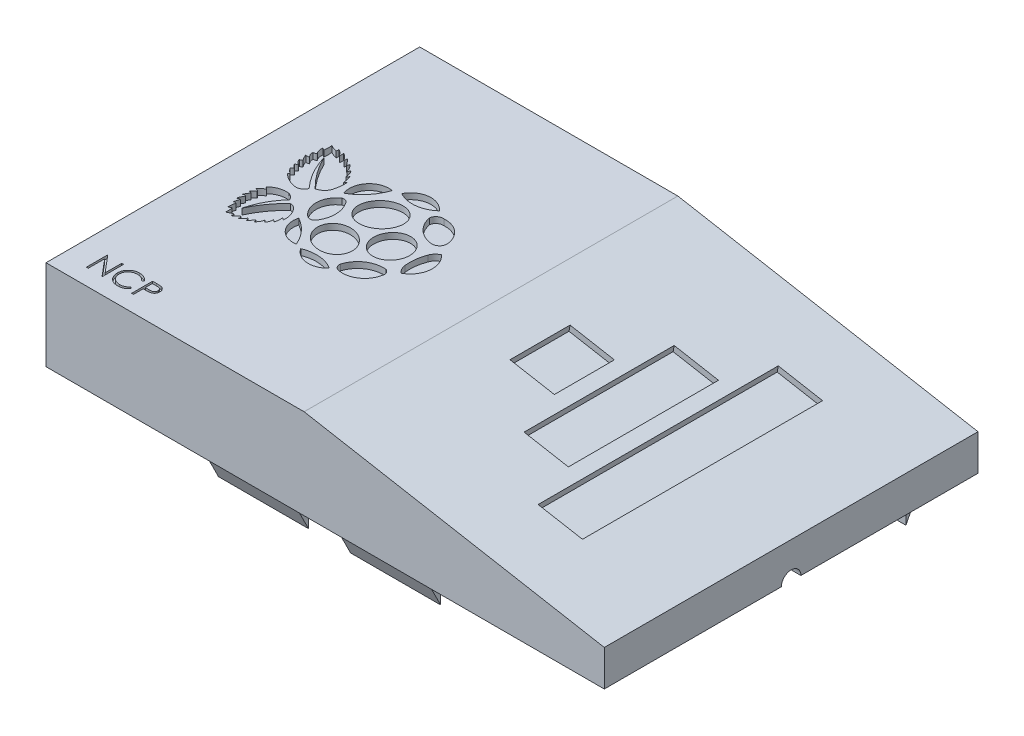
from build123d import *

# Parameters (mm, degrees)
BOSS_EXTRUDE1_DEPTH  = 62.25
SHELL2_T             = -3
SKETCH2_RX           = 3.23434453
SKETCH2_RY           = 2.836223113
SKETCH2_RX_2         = 3.027402498
SKETCH2_RY_2         = 2.793583879
SKETCH2_RX_3         = 3.441458498
SKETCH2_RY_3         = 2.879392248
CUT_EXTRUDE1_DEPTH   = 1
CUT_EXTRUDE2_DEPTH   = 0.5
CUT_EXTRUDE3_DEPTH   = 3
SKETCH5_W            = 7.5
SKETCH5_H            = 40
SKETCH5_H_2          = 25
SKETCH5_H_3          = 10
CUT_EXTRUDE4_DEPTH   = 1
SKETCH6_R            = 1.75
BOSS_EXTRUDE2_DEPTH  = 10.25
SKETCH7_R            = 0.775
BOSS_EXTRUDE3_DEPTH  = 5.75
BOSS_EXTRUDE4_REACH  = 114.912
SKETCH8_W            = 15
SKETCH8_H            = 3
BOSS_EXTRUDE5_REACH  = 114.912
SKETCH9_W            = 15
SKETCH9_H            = 3
SKETCH10_W           = 15
SKETCH10_H           = 1
BOSS_EXTRUDE6_DEPTH  = 5.5
BOSS_EXTRUDE8_DEPTH  = 15
SKETCH14_W           = 5
SKETCH14_H           = 5
BOSS_EXTRUDE9_DEPTH  = 8.25
BOSS_EXTRUDE10_DEPTH = 15
BOSS_EXTRUDE11_DEPTH = 15


with BuildPart() as part:
    # Sketch1 → Boss-Extrude1 (new body)
    with BuildSketch(Plane.XY):
        Polygon((93, 0), (93, 6), (43, 15), (0, 15), (0, 0), align=None)
    extrude(amount=BOSS_EXTRUDE1_DEPTH)

    # Shell2
    shell2_openings = [part.faces().sort_by_distance(p)[0] for p in [
        (46.5, 0, 31.125),
    ]]
    offset(amount=SHELL2_T, openings=shell2_openings, kind=Kind.INTERSECTION)

    # Sketch2 → Cut-Extrude1 (cut)
    with BuildSketch(Plane(origin=(0, 15, 0), x_dir=(1, 0, 0), z_dir=(0, 1, 0))):
        with Locations(Location((20.631271905, -34.758953335), (0, 0, -23.180752632))):
            Ellipse(SKETCH2_RX, SKETCH2_RY)
        with Locations(Location((26.430753429, -31.093375761), (0, 0, 67.737970758))):
            Ellipse(SKETCH2_RX_2, SKETCH2_RY_2)
        with Locations(Location((20.972849689, -27.417458451), (0, 0, 38.365764852))):
            Ellipse(SKETCH2_RX_3, SKETCH2_RY_3)
        with BuildLine():
            ThreePointArc((19.185670236, -38.995990222), (21.842438252, -38.58362755), (24.394817778, -39.428505064))
            ThreePointArc((24.394817778, -39.428505064), (21.682718032, -40.507275271), (19.185670236, -38.995990222))
        make_face()
        with BuildLine():
            ThreePointArc((18.166589072, -38.720020325), (15.308161244, -37.710999288), (14.619570081, -34.758953335))
            ThreePointArc((14.619570081, -34.758953335), (16.725817208, -36.441530067), (18.166589072, -38.720020325))
        make_face()
        with BuildLine():
            ThreePointArc((24.716824031, -37.876288705), (24.858709382, -38.594954098), (25.470039922, -38.998545936))
            ThreePointArc((25.470039922, -38.998545936), (28.268081035, -38.418240356), (29.840480019, -36.03216616))
            ThreePointArc((29.840480019, -36.03216616), (29.78091761, -35.332578316), (29.244117319, -34.880011991))
            ThreePointArc((29.244117319, -34.880011991), (26.454283148, -35.583095189), (24.716824031, -37.876288705))
        make_face()
        with BuildLine():
            ThreePointArc((31.099176128, -34.170223925), (33.031172545, -31.349868691), (31.784927148, -28.166492148))
            ThreePointArc((31.784927148, -28.166492148), (31.137173961, -28.624802335), (30.71685995, -29.297831718))
            ThreePointArc((30.71685995, -29.297831718), (30.296643254, -30.984618483), (30.285678757, -32.722925545))
            ThreePointArc((30.285678757, -32.722925545), (30.545941708, -33.528911427), (31.099176128, -34.170223925))
        make_face()
        with BuildLine():
            ThreePointArc((15.308161244, -33.895118663), (13.825431994, -31.093375761), (15.308161244, -28.29163286))
            ThreePointArc((15.308161244, -28.29163286), (15.963769898, -28.308210395), (16.415633136, -28.783517808))
            ThreePointArc((16.415633136, -28.783517808), (17.111216318, -31.083876315), (16.491877072, -33.405923715))
            ThreePointArc((16.491877072, -33.405923715), (16.001334749, -33.895676764), (15.308161244, -33.895118663))
        make_face()
        with BuildLine():
            ThreePointArc((19.658735939, -22.647390073), (22.574976673, -23.238989758), (25.283843408, -22.007530779))
            ThreePointArc((25.283843408, -22.007530779), (22.298505034, -20.80848246), (19.658735939, -22.647390073))
        make_face()
        with BuildLine():
            ThreePointArc((30.71685995, -26.154029327), (29.465454563, -23.656015485), (26.814214801, -22.774530193))
            ThreePointArc((26.814214801, -22.774530193), (25.920656617, -23.030820136), (25.470039922, -23.843885544))
            ThreePointArc((25.470039922, -23.843885544), (26.841313913, -26.284543001), (29.401334179, -27.417458451))
            ThreePointArc((29.401334179, -27.417458451), (30.320761804, -27.058198197), (30.71685995, -26.154029327))
        make_face()
        with BuildLine():
            ThreePointArc((14.767462088, -27.417458451), (17.012003821, -25.556638731), (18.419100349, -23.003073186))
            ThreePointArc((18.419100349, -23.003073186), (15.302587522, -24.142586809), (14.767462088, -27.417458451))
        make_face()
        with BuildLine():
            ThreePointArc((11.751124031, -29.17536075), (9.635588773, -26.71867726), (7.985576374, -23.927935015))
            ThreePointArc((7.985576374, -23.927935015), (9.267010798, -26.972614766), (11.219001446, -29.637550317))
            ThreePointArc((11.219001446, -29.637550317), (10.735019108, -30.257573014), (10.00410177, -30.548136076))
            ThreePointArc((10.00410177, -30.548136076), (8.498848306, -30.153077222), (7.232695965, -29.248246995))
            ThreePointArc((7.232695965, -29.248246995), (7.37305971, -29.184304352), (7.463335639, -29.059240771))
            ThreePointArc((7.463335639, -29.059240771), (7.014832676, -28.68009702), (6.644712677, -28.224118865))
            ThreePointArc((6.644712677, -28.224118865), (6.869538831, -28.113666589), (7.025438864, -27.917601077))
            ThreePointArc((7.025438864, -27.917601077), (6.683487621, -27.632259645), (6.426811997, -27.268298096))
            ThreePointArc((6.426811997, -27.268298096), (6.661203353, -27.192178891), (6.773118664, -26.972614766))
            ThreePointArc((6.773118664, -26.972614766), (6.386561226, -26.669975183), (6.210587584, -26.211662356))
            ThreePointArc((6.210587584, -26.211662356), (6.448864602, -26.197888677), (6.607612436, -26.019661921))
            ThreePointArc((6.607612436, -26.019661921), (6.296357608, -25.563867131), (6.111687011, -25.043746734))
            ThreePointArc((6.111687011, -25.043746734), (6.400927747, -25.125688799), (6.685359918, -25.028359229))
            ThreePointArc((6.685359918, -25.028359229), (6.399917656, -24.58920021), (6.324178136, -24.070932466))
            ThreePointArc((6.324178136, -24.070932466), (6.607612436, -24.05547907), (6.825070706, -23.873035351))
            ThreePointArc((6.825070706, -23.873035351), (6.540131271, -23.284926697), (6.53816595, -22.631429638))
            ThreePointArc((6.53816595, -22.631429638), (6.712331192, -22.761572665), (6.902343049, -22.867243065))
            ThreePointArc((6.902343049, -22.867243065), (6.938252957, -22.193310389), (6.902343049, -21.519377713))
            ThreePointArc((6.902343049, -21.519377713), (7.448107739, -21.789561041), (8.035360737, -21.95078152))
            ThreePointArc((8.035360737, -21.95078152), (8.080869441, -21.7297657), (8.05421252, -21.505693293))
            ThreePointArc((8.05421252, -21.505693293), (8.573506731, -21.871613602), (8.976097896, -22.363024331))
            ThreePointArc((8.976097896, -22.363024331), (9.051359196, -22.002256971), (8.976097896, -21.641489611))
            ThreePointArc((8.976097896, -21.641489611), (9.571020242, -22.062954422), (10.00410177, -22.649474305))
            ThreePointArc((10.00410177, -22.649474305), (10.087922339, -22.420796241), (10.111101081, -22.178345646))
            ThreePointArc((10.111101081, -22.178345646), (10.587461655, -22.649474305), (10.985307512, -23.188547847))
            ThreePointArc((10.985307512, -23.188547847), (11.084012341, -22.986854403), (11.157096668, -22.774530193))
            ThreePointArc((11.157096668, -22.774530193), (11.619719738, -23.322092661), (11.901316316, -23.981295308))
            ThreePointArc((11.901316316, -23.981295308), (12.053319009, -23.800204284), (12.132092522, -23.57728387))
            ThreePointArc((12.132092522, -23.57728387), (12.470152649, -24.16846626), (12.580830754, -24.840427289))
            ThreePointArc((12.580830754, -24.840427289), (12.77239144, -24.699316611), (12.90167999, -24.499586315))
            ThreePointArc((12.90167999, -24.499586315), (13.094991638, -25.18121396), (13.205333447, -25.881078465))
            ThreePointArc((13.205333447, -25.881078465), (13.381113204, -25.742603991), (13.528203923, -25.57396822))
            ThreePointArc((13.528203923, -25.57396822), (13.512795769, -26.501513065), (13.365755297, -27.417458451))
            ThreePointArc((13.365755297, -27.417458451), (12.837442533, -28.552673418), (11.751124031, -29.17536075))
        make_face()
        with BuildLine():
            ThreePointArc((13.605414659, -36.318076611), (13.498458727, -35.136716824), (12.997756974, -34.061380471))
            ThreePointArc((12.997756974, -34.061380471), (12.492924369, -33.555602946), (11.805799387, -33.35932222))
            ThreePointArc((11.805799387, -33.35932222), (9.892492412, -35.554038044), (8.436697165, -38.075581485))
            ThreePointArc((8.436697165, -38.075581485), (9.49602013, -35.306132831), (11.203487812, -32.881970067))
            ThreePointArc((11.203487812, -32.881970067), (10.811735268, -32.339768722), (10.233723882, -32.003086095))
            ThreePointArc((10.233723882, -32.003086095), (8.670972956, -32.154514728), (7.3610336, -33.020066559))
            ThreePointArc((7.3610336, -33.020066559), (7.579950403, -33.104877308), (7.752534528, -33.264038073))
            ThreePointArc((7.752534528, -33.264038073), (7.213574572, -33.616322393), (6.75760503, -34.070936351))
            ThreePointArc((6.75760503, -34.070936351), (7.051006992, -34.140049949), (7.277374173, -34.339095925))
            ThreePointArc((7.277374173, -34.339095925), (6.904175554, -34.629644492), (6.592098801, -34.985036924))
            ThreePointArc((6.592098801, -34.985036924), (6.834031953, -35.011315135), (7.051006992, -35.121515074))
            ThreePointArc((7.051006992, -35.121515074), (6.729000874, -35.529870649), (6.496018821, -35.99480245))
            ThreePointArc((6.496018821, -35.99480245), (6.755668882, -35.91427056), (7.00992523, -36.010485158))
            ThreePointArc((7.00992523, -36.010485158), (6.718960287, -36.53182792), (6.522652316, -37.095673692))
            ThreePointArc((6.522652316, -37.095673692), (6.779425822, -36.969598454), (7.063811622, -36.938738839))
            ThreePointArc((7.063811622, -36.938738839), (6.897044504, -37.409309824), (6.834031953, -37.904565052))
            ThreePointArc((6.834031953, -37.904565052), (7.029997052, -37.793358402), (7.247200278, -37.853291676))
            ThreePointArc((7.247200278, -37.853291676), (7.103093714, -38.472352232), (7.111126027, -39.107913525))
            ThreePointArc((7.111126027, -39.107913525), (7.31167282, -38.935411013), (7.52964566, -38.785531148))
            ThreePointArc((7.52964566, -38.785531148), (7.666908764, -39.395322635), (7.618990005, -40.018532559))
            ThreePointArc((7.618990005, -40.018532559), (8.116769004, -39.7536522), (8.641559274, -39.54739821))
            ThreePointArc((8.641559274, -39.54739821), (8.642255696, -39.7854208), (8.594150125, -40.018532559))
            ThreePointArc((8.594150125, -40.018532559), (9.094097677, -39.734432014), (9.445237768, -39.279062593))
            ThreePointArc((9.445237768, -39.279062593), (9.641766594, -39.511186579), (9.616597015, -39.81428989))
            ThreePointArc((9.616597015, -39.81428989), (10.067422402, -39.467270281), (10.386109152, -38.995990222))
            ThreePointArc((10.386109152, -38.995990222), (10.516261514, -39.215443686), (10.557283781, -39.467270281))
            ThreePointArc((10.557283781, -39.467270281), (10.962236903, -39.043554997), (11.313447943, -38.574329594))
            ThreePointArc((11.313447943, -38.574329594), (11.419755277, -38.772728326), (11.448346047, -38.995990222))
            ThreePointArc((11.448346047, -38.995990222), (11.860994573, -38.474010937), (12.074288796, -37.843735795))
            ThreePointArc((12.074288796, -37.843735795), (12.227921415, -38.019403411), (12.290432759, -38.244246523))
            ThreePointArc((12.290432759, -38.244246523), (12.6356413, -37.723904453), (12.720147908, -37.105209504))
            ThreePointArc((12.720147908, -37.105209504), (12.928043084, -37.217676076), (13.078763965, -37.399753943))
            ThreePointArc((13.078763965, -37.399753943), (13.237628543, -36.734205165), (13.205333447, -36.050721326))
            ThreePointArc((13.205333447, -36.050721326), (13.416456641, -36.167814539), (13.605414659, -36.318076611))
        make_face()
    extrude(amount=-CUT_EXTRUDE1_DEPTH, mode=Mode.SUBTRACT)

    # Sketch3 → Cut-Extrude2 (cut)
    # profile 1 of 3: a face of its own
    with BuildSketch(Plane(origin=(0, 15, 0), x_dir=(1, 0, 0), z_dir=(0, 1, 0))):
        Polygon((4.004218303, -59.534994611), (4.004218303, -56.034994611), (4.070123752, -56.034994611), (6.382423431, -58.789702143), (6.382423431, -56.034994611), (6.696525995, -56.034994611), (6.696525995, -59.534994611), (6.625011572, -59.534994611), (4.318320867, -56.786597175), (4.318320867, -59.534994611), align=None)
    # profile 2 of 3: a face of its own
    with BuildSketch(Plane(origin=(0, 15, 0), x_dir=(1, 0, 0), z_dir=(0, 1, 0))):
        with BuildLine():
            Line((10.824731123, -56.677222175), (10.54989138, -56.887558713))
            add(Edge.make_bspline(
                [(10.54989138, -56.887558713), (10.530285491, -56.864192743), (10.491338045, -56.817775828), (10.428678842, -56.752596283), (10.363377199, -56.691531022), (10.295458078, -56.634289142), (10.223698959, -56.582872376), (10.14983816, -56.534601273), (10.072640115, -56.491333535), (9.96588838, -56.438870549), (9.826240532, -56.384124394), (9.650445693, -56.338221163), (9.466934594, -56.308999987), (9.341736995, -56.305835146), (9.278056444, -56.30422538)],
                knots=[0, 0, 0, 0, 0.757959112, 1.505699292, 2.245454638, 2.979532153, 3.711538275, 4.438200793, 5.171680507, 5.909471876, 7.393775596, 8.890124382, 10.418191784, 12, 12, 12, 12], degree=3))
            add(Edge.make_bspline(
                [(9.278056444, -56.30422538), (9.242973145, -56.304629342), (9.173132152, -56.305433518), (9.069483679, -56.316042643), (8.967770627, -56.330953853), (8.868059161, -56.353079177), (8.770476203, -56.381051796), (8.674383801, -56.41447721), (8.581173201, -56.45583205), (8.489554963, -56.50154031), (8.401775752, -56.553167754), (8.318720704, -56.609481106), (8.240692736, -56.669850203), (8.167630124, -56.734501309), (8.099458175, -56.803143269), (8.036670865, -56.876507611), (7.979485454, -56.954359785), (7.926768429, -57.035673192), (7.879555696, -57.120210984), (7.840025817, -57.208286054), (7.805020694, -57.298390157), (7.777321452, -57.391541318), (7.755396935, -57.487084084), (7.740269272, -57.585274872), (7.7297808, -57.685908551), (7.728980623, -57.754117864), (7.728577277, -57.78850022)],
                knots=[0, 0, 0, 0, 1.054917814, 2.100044995, 3.131103042, 4.146048494, 5.169673617, 6.183595914, 7.203665975, 8.234915748, 9.262203917, 10.264457458, 11.251630812, 12.227803204, 13.197192746, 14.159520551, 15.12972552, 16.100847026, 17.073214652, 18.039054194, 19.002613845, 19.979014051, 20.95965708, 21.949030935, 22.966165397, 24, 24, 24, 24], degree=3))
            add(Edge.make_bspline(
                [(7.728577277, -57.78850022), (7.729839096, -57.84023154), (7.732316511, -57.941799124), (7.754364845, -58.090569735), (7.787869936, -58.233090409), (7.838085513, -58.368470251), (7.900004563, -58.498378609), (7.978245175, -58.620617462), (8.068861712, -58.737034027), (8.173136132, -58.844876975), (8.287541948, -58.9433907), (8.410289859, -59.030141282), (8.541074147, -59.102456164), (8.678450777, -59.162632111), (8.823476891, -59.208888838), (8.975891694, -59.241452962), (9.135363689, -59.262695142), (9.244333089, -59.26472883), (9.29979122, -59.265763841)],
                knots=[0, 0, 0, 0, 1.029171465, 2.020641659, 2.987623507, 3.938342917, 4.889210282, 5.84687017, 6.821220943, 7.821438502, 8.827599549, 9.822697543, 10.807740252, 11.797342354, 12.80366471, 13.83203677, 14.896651826, 16, 16, 16, 16], degree=3))
            add(Edge.make_bspline(
                [(9.29979122, -59.265763841), (9.360893909, -59.264075062), (9.481158617, -59.260751139), (9.657526644, -59.23259189), (9.826362409, -59.186933972), (9.987674996, -59.12303605), (10.141009642, -59.039970762), (10.286606303, -58.939272885), (10.424587873, -58.819984552), (10.507559155, -58.728901423), (10.54989138, -58.682430508)],
                knots=[0, 0, 0, 0, 1.028121516, 2.023589091, 2.998037872, 3.967518031, 4.937445131, 5.927275754, 6.942489185, 8, 8, 8, 8], degree=3))
            Line((10.54989138, -58.682430508), (10.824731123, -58.890663681))
            add(Edge.make_bspline(
                [(10.824731123, -58.890663681), (10.802613014, -58.919202133), (10.758482738, -58.976142339), (10.687024721, -59.056414049), (10.611747424, -59.131918085), (10.532091714, -59.202045706), (10.448973922, -59.268200171), (10.36090161, -59.328502003), (10.269032577, -59.383792887), (10.173678099, -59.434419811), (10.074939486, -59.479337058), (9.972935051, -59.517790826), (9.868104475, -59.550915716), (9.760442967, -59.578167653), (9.64972721, -59.599438736), (9.536356736, -59.613658411), (9.420086861, -59.623400326), (9.34164544, -59.624288242), (9.301894585, -59.6247382)],
                knots=[0, 0, 0, 0, 0.986787822, 1.968848986, 2.935600012, 3.899624008, 4.868462664, 5.837806735, 6.815139263, 7.798259679, 8.787526145, 9.778297419, 10.776456485, 11.791383307, 12.812564526, 13.85620153, 14.913611965, 16, 16, 16, 16], degree=3))
            add(Edge.make_bspline(
                [(9.301894585, -59.6247382), (9.264250918, -59.624476208), (9.189815228, -59.62395815), (9.079916476, -59.615565983), (8.972926895, -59.604116246), (8.86915227, -59.586876115), (8.768026294, -59.566531775), (8.67046571, -59.539260518), (8.5755105, -59.508711351), (8.483542159, -59.472806365), (8.394482459, -59.432290182), (8.308618648, -59.386498623), (8.225990215, -59.335816758), (8.145784795, -59.281361748), (8.069187211, -59.221384446), (7.995533685, -59.156717812), (7.924411209, -59.087579801), (7.880408524, -59.037724948), (7.858284809, -59.012658873)],
                knots=[0, 0, 0, 0, 1.114604814, 2.203992996, 3.262667896, 4.300477797, 5.318619304, 6.316056647, 7.298880507, 8.271930387, 9.238335007, 10.195173496, 11.151986948, 12.108099108, 13.064862484, 14.031167946, 15.010108607, 16, 16, 16, 16], degree=3))
            add(Edge.make_bspline(
                [(7.858284809, -59.012658873), (7.822849166, -58.969117685), (7.752405689, -58.882560974), (7.662280005, -58.742274993), (7.58513245, -58.595806784), (7.522756529, -58.442386855), (7.473993796, -58.282359468), (7.440212601, -58.115643954), (7.418260997, -57.942396011), (7.415750708, -57.824559223), (7.414474713, -57.764662079)],
                knots=[0, 0, 0, 0, 0.994628077, 1.977248131, 2.950237994, 3.925870899, 4.908910175, 5.911660606, 6.938484602, 8, 8, 8, 8], degree=3))
            add(Edge.make_bspline(
                [(7.414474713, -57.764662079), (7.416029907, -57.701706625), (7.419089653, -57.5778457), (7.445085448, -57.396071747), (7.486904245, -57.221920348), (7.546301133, -57.055716604), (7.621606485, -56.896586324), (7.714633098, -56.745745119), (7.824300241, -56.602228319), (7.949747808, -56.468213568), (8.087315144, -56.345674215), (8.234633957, -56.237868011), (8.391415904, -56.148150495), (8.555933756, -56.073154333), (8.729419438, -56.01550987), (8.911502807, -55.975156683), (9.101841722, -55.950039567), (9.231704147, -55.946864359), (9.297687854, -55.945251021)],
                knots=[0, 0, 0, 0, 1.032925535, 2.032216505, 3.007276963, 3.968222605, 4.92396291, 5.891752235, 6.871517503, 7.883894988, 8.900124299, 9.891468569, 10.874487609, 11.85992873, 12.854644235, 13.869047385, 14.917252991, 16, 16, 16, 16], degree=3))
            add(Edge.make_bspline(
                [(9.297687854, -55.945251021), (9.337902326, -55.945733159), (9.417502823, -55.946687503), (9.535255476, -55.955993645), (9.649897803, -55.971507251), (9.761508785, -55.992623321), (9.870631401, -56.018830643), (9.976431642, -56.052970941), (10.079530329, -56.092007472), (10.179277237, -56.136965938), (10.275193787, -56.18743268), (10.367250106, -56.242848303), (10.454714964, -56.303144109), (10.538203813, -56.367807284), (10.616320024, -56.438205843), (10.691281502, -56.512403439), (10.760542581, -56.592537264), (10.803295776, -56.648942197), (10.824731123, -56.677222175)],
                knots=[0, 0, 0, 0, 1.096760587, 2.17092713, 3.219439832, 4.250915756, 5.268269357, 6.278326846, 7.281116186, 8.274029601, 9.260640565, 10.235837813, 11.203064059, 12.156899882, 13.114053108, 14.069676657, 15.032185724, 16, 16, 16, 16], degree=3))
        make_face()
    # profile 3 of 3: a face of its own
    with BuildSketch(Plane(origin=(0, 15, 0), x_dir=(1, 0, 0), z_dir=(0, 1, 0))):
        with BuildLine():
            Line((11.542679841, -56.034994611), (12.229078079, -56.034994611))
            add(Edge.make_bspline(
                [(12.229078079, -56.034994611), (12.276288985, -56.035046507), (12.366747178, -56.035145942), (12.496462233, -56.038160688), (12.614271965, -56.04218738), (12.719922346, -56.047769273), (12.813738444, -56.054365864), (12.895295743, -56.063617903), (12.9652353, -56.073278199), (13.007141749, -56.083099605), (13.026253559, -56.087578745)],
                knots=[0, 0, 0, 0, 1.415646017, 2.712440637, 3.8905458, 4.950247383, 5.884950622, 6.709939814, 7.411656543, 8, 8, 8, 8], degree=3))
            add(Edge.make_bspline(
                [(13.026253559, -56.087578745), (13.050447093, -56.094200695), (13.09826407, -56.107288557), (13.167165113, -56.13350228), (13.232718959, -56.164584445), (13.295150517, -56.200008385), (13.3536926, -56.241293949), (13.409218641, -56.286767567), (13.461238622, -56.337479136), (13.509460014, -56.392859876), (13.553744811, -56.451980085), (13.591874494, -56.515722315), (13.623801721, -56.583013619), (13.651184992, -56.65380719), (13.670893447, -56.728697513), (13.685740347, -56.807164226), (13.695163974, -56.889198916), (13.696066536, -56.945258784), (13.696525995, -56.973796694)],
                knots=[0, 0, 0, 0, 0.999701418, 1.975846123, 2.934577507, 3.890451536, 4.834027766, 5.787354733, 6.749476667, 7.726910423, 8.712836071, 9.690891519, 10.682875813, 11.679750201, 12.712814741, 13.765529915, 14.8625177, 16, 16, 16, 16], degree=3))
            add(Edge.make_bspline(
                [(13.696525995, -56.973796694), (13.69610457, -57.002574471), (13.695280025, -57.058880135), (13.685383739, -57.141252923), (13.672053548, -57.219971313), (13.651556495, -57.294860763), (13.624710822, -57.365476534), (13.593218769, -57.432897766), (13.555235239, -57.495977438), (13.511590409, -57.554944555), (13.463038815, -57.609854468), (13.409785877, -57.660309262), (13.352046584, -57.706013601), (13.290004436, -57.747069944), (13.223054587, -57.782526224), (13.152212434, -57.814283529), (13.076862217, -57.840954589), (13.024719703, -57.854984651), (12.998208688, -57.862118008)],
                knots=[0, 0, 0, 0, 1.121902311, 2.195077645, 3.232258892, 4.234102512, 5.217864754, 6.176164875, 7.132989551, 8.084763148, 9.034132444, 9.988522005, 10.94243251, 11.903244335, 12.886203696, 13.894208494, 14.929344452, 16, 16, 16, 16], degree=3))
            add(Edge.make_bspline(
                [(12.998208688, -57.862118008), (12.976281354, -57.866780989), (12.928226326, -57.877000183), (12.849083604, -57.88840864), (12.756938218, -57.898146241), (12.651915938, -57.905447378), (12.534111033, -57.911697747), (12.403459776, -57.916665841), (12.259705699, -57.919395695), (12.159434455, -57.919536487), (12.107082886, -57.919609995)],
                knots=[0, 0, 0, 0, 0.601384939, 1.31797006, 2.144135048, 3.087295005, 4.142315834, 5.309527816, 6.595305764, 8, 8, 8, 8], degree=3))
            Line((12.107082886, -57.919609995), (11.856782405, -57.919609995))
            Line((11.856782405, -57.919609995), (11.856782405, -59.534994611))
            Line((11.856782405, -59.534994611), (11.542679841, -59.534994611))
            Line((11.542679841, -59.534994611), (11.542679841, -56.034994611))
        make_face()
        with BuildLine():
            Line((11.856782405, -56.39396897), (11.856782405, -57.560635636))
            Line((11.856782405, -57.560635636), (12.469562854, -57.568347976))
            add(Edge.make_bspline(
                [(12.469562854, -57.568347976), (12.49948278, -57.56836344), (12.55724258, -57.568393292), (12.640678803, -57.564408068), (12.71808809, -57.559807536), (12.789232666, -57.553071612), (12.8541446, -57.543550355), (12.912932129, -57.533938617), (12.965139412, -57.520033254), (13.026238614, -57.501310185), (13.094321961, -57.469377569), (13.16838951, -57.423027679), (13.231160096, -57.363946971), (13.285478393, -57.29751914), (13.328584271, -57.22362001), (13.360140263, -57.144551074), (13.378681421, -57.061123224), (13.381167614, -57.004035085), (13.382423431, -56.975198938)],
                knots=[0, 0, 0, 0, 1.160613943, 2.240541288, 3.23993089, 4.169200891, 5.011653406, 5.7853311, 6.478053781, 7.106038997, 8.262395093, 9.384106736, 10.481365981, 11.59014053, 12.70357646, 13.786202915, 14.881775077, 16, 16, 16, 16], degree=3))
            add(Edge.make_bspline(
                [(13.382423431, -56.975198938), (13.381160785, -56.947060424), (13.3786508, -56.891124542), (13.359994937, -56.809145781), (13.328645623, -56.730910077), (13.285189028, -56.657936992), (13.232447898, -56.591748188), (13.171148555, -56.534251061), (13.101435294, -56.488029358), (13.036587063, -56.458196076), (12.978985877, -56.439980801), (12.928953917, -56.42723596), (12.872463242, -56.417060354), (12.809495463, -56.408820851), (12.740538629, -56.40176739), (12.665000314, -56.396981413), (12.583166671, -56.394179957), (12.5263561, -56.394041001), (12.496906604, -56.39396897)],
                knots=[0, 0, 0, 0, 1.120700087, 2.227813068, 3.331159281, 4.466773991, 5.599788987, 6.693661531, 7.80175334, 8.91857717, 9.525282508, 10.207424825, 10.974604443, 11.810962634, 12.737642355, 13.736264703, 14.826523623, 16, 16, 16, 16], degree=3))
            Line((12.496906604, -56.39396897), (11.856782405, -56.39396897))
        make_face(mode=Mode.SUBTRACT)
    extrude(amount=-CUT_EXTRUDE2_DEPTH, mode=Mode.SUBTRACT)

    # Sketch4 → Cut-Extrude3 (cut)
    with BuildSketch(Plane(origin=(93, 0, 0), x_dir=(0, 0, -1), z_dir=(1, 0, 0))):
        with BuildLine():
            Line((-32.75, 0), (-29.5, 0))
            ThreePointArc((-29.5, 0), (-31.125, 1.625), (-32.75, 0))
        make_face()
    extrude(amount=-CUT_EXTRUDE3_DEPTH, mode=Mode.SUBTRACT)

    # Sketch5 → Cut-Extrude4 (cut)
    with BuildSketch(Plane(origin=(3.964742348, 22.026346377, 0), x_dir=(0.9841833239736953, -0.1771529983152652, 0), z_dir=(0.17715299831526518, 0.9841833239736952, 0))):
        with Locations((71.71613114, -31.125)):
            Rectangle(SKETCH5_W, SKETCH5_H)
        with Locations((61.71613114, -31.125)):
            Rectangle(SKETCH5_W, SKETCH5_H_2)
        with Locations((51.71613114, -31.125)):
            Rectangle(SKETCH5_W, SKETCH5_H_3)
    extrude(amount=-CUT_EXTRUDE4_DEPTH, mode=Mode.SUBTRACT)

    # Sketch6 → Boss-Extrude2 (add)
    with BuildSketch(Plane.XZ.offset(-12)):
        with Locations(Location((34.75, 10.75, 0), (0, 0, 90))):
            Circle(SKETCH6_R)
        with Locations(Location((8.25, 29.25, 0), (0, 0, 90))):
            Circle(SKETCH6_R)
    extrude(amount=BOSS_EXTRUDE2_DEPTH)

    # Sketch7 → Boss-Extrude3 (add)
    with BuildSketch(Plane.XZ.offset(-1.75)):
        with Locations(Location((8.25, 29.25, 0), (0, 0, 270))):
            Circle(SKETCH7_R)
        with Locations(Location((34.75, 10.75, 0), (0, 0, 270))):
            Circle(SKETCH7_R)
    extrude(amount=BOSS_EXTRUDE3_DEPTH)

    # Boss-Extrude4: up to this plane
    boss_extrude4_end = Plane(origin=(3.433283353, 19.073796405, 62.25), z_dir=(-0.17715299831526518, -0.9841833239736953, 0))
    # Sketch8 → Boss-Extrude4 (add, up to the surface)
    with BuildSketch(Plane.XZ, mode=Mode.PRIVATE) as boss_extrude4_sk1:
        with Locations((79.5, 4.5)):
            Rectangle(SKETCH8_W, SKETCH8_H)
    boss_extrude4_tool1 = split(extrude(boss_extrude4_sk1.sketch, amount=-BOSS_EXTRUDE4_REACH, mode=Mode.PRIVATE), bisect_by=boss_extrude4_end, keep=Keep.BOTH, mode=Mode.PRIVATE)
    add(boss_extrude4_tool1.solids().sort_by_distance((79.5, 0, 4.5))[0])
    # Sketch8 → Boss-Extrude4 (add, up to the surface)
    with BuildSketch(Plane.XZ, mode=Mode.PRIVATE) as boss_extrude4_sk2:
        with Locations((52.232152272, 57.75)):
            Rectangle(SKETCH8_W, SKETCH8_H)
    boss_extrude4_tool2 = split(extrude(boss_extrude4_sk2.sketch, amount=-BOSS_EXTRUDE4_REACH, mode=Mode.PRIVATE), bisect_by=boss_extrude4_end, keep=Keep.BOTH, mode=Mode.PRIVATE)
    add(boss_extrude4_tool2.solids().sort_by_distance((52.232152, 0, 57.75))[0])

    # Sketch9 → Boss-Extrude5 (add, up to next)
    with BuildSketch(Plane.XZ, mode=Mode.PRIVATE) as boss_extrude5_sk1:
        with Locations((30.232152272, 57.75)):
            Rectangle(SKETCH9_W, SKETCH9_H)
    boss_extrude5_tool1 = extrude(boss_extrude5_sk1.sketch, amount=-BOSS_EXTRUDE5_REACH, mode=Mode.PRIVATE) - part.part
    add(boss_extrude5_tool1.solids().sort_by_distance((30.232152, 0, 57.75))[0])

    # Sketch10 → Boss-Extrude6 (add)
    with BuildSketch(Plane(origin=(0, 0, 0), x_dir=(-1, 0, 0), z_dir=(0, -1, 0))):
        with Locations((-79.5, -5.5)):
            Rectangle(SKETCH10_W, SKETCH10_H)
        with Locations((-52.232152272, -56.75)):
            Rectangle(SKETCH10_W, SKETCH10_H)
        with Locations((-30.232152272, -56.75)):
            Rectangle(SKETCH10_W, SKETCH10_H)
    extrude(amount=BOSS_EXTRUDE6_DEPTH)

    # Sketch12 → Boss-Extrude8 (add)
    with BuildSketch(Plane(origin=(37.732152272, 0, 0), x_dir=(0, 0, -1), z_dir=(1, 0, 0))):
        Polygon((-57.25, -5.5), (-57.75, -4.5), (-57.25, -4.5), (-56.25, -4.5), (-56.25, -7.5), align=None)
    extrude(amount=-BOSS_EXTRUDE8_DEPTH)

    # Sketch14 → Boss-Extrude9 (add)
    with BuildSketch(Plane.XZ.offset(-12)):
        with Locations((8.25, 29.25)):
            Rectangle(SKETCH14_W, SKETCH14_H)
        with Locations((34.75, 10.75)):
            Rectangle(SKETCH14_W, SKETCH14_H)
    extrude(amount=BOSS_EXTRUDE9_DEPTH)

    # Sketch15 → Boss-Extrude10 (add)
    with BuildSketch(Plane(origin=(87, 0, 0), x_dir=(0, 0, -1), z_dir=(1, 0, 0))):
        Polygon((-5, -4.5), (-4.5, -4.5), (-6, -7.5), (-6, -4.5), align=None)
    extrude(amount=-BOSS_EXTRUDE10_DEPTH)

    # Sketch16 → Boss-Extrude11 (add)
    with BuildSketch(Plane(origin=(59.732152272, 0, 0), x_dir=(0, 0, -1), z_dir=(1, 0, 0))):
        Polygon((-56.25, -4.5), (-56.25, -7.5), (-57.75, -4.5), align=None)
    extrude(amount=-BOSS_EXTRUDE11_DEPTH)


solid = part.part
